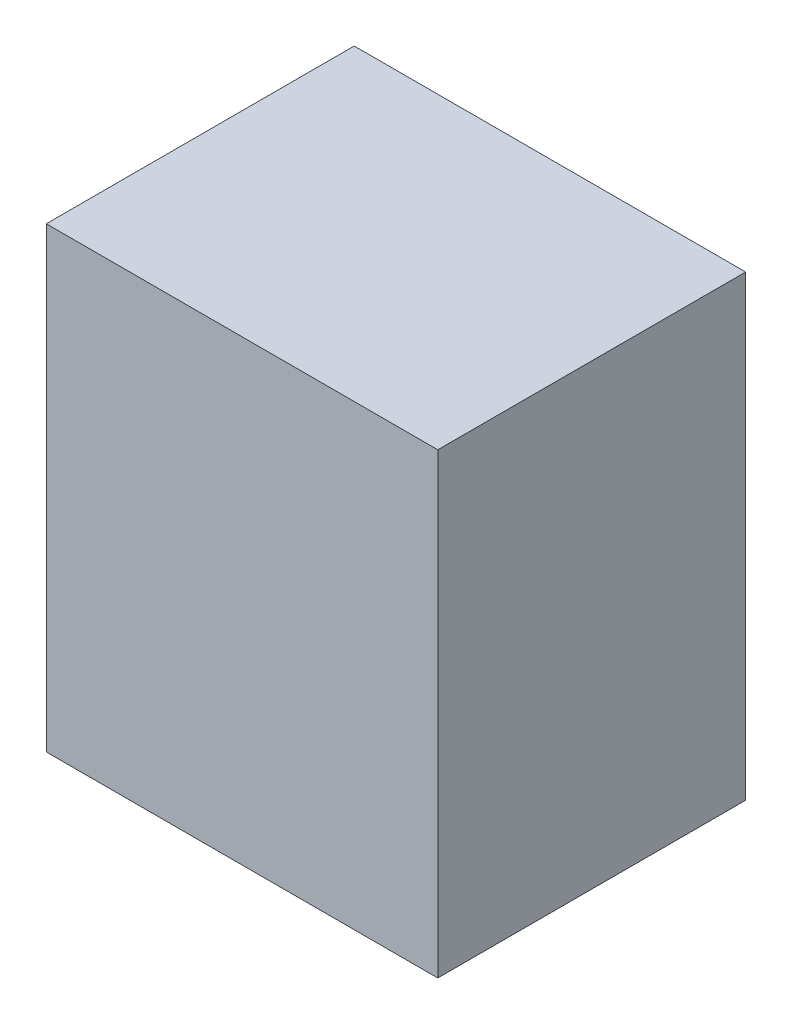
from build123d import *

# Parameters (mm, degrees)
SZKIC6_W                     = 170
SZKIC6_H                     = 200
DODANIE_WYCI_GNI_CIE3_DEPTH  = 4
SZKIC7_R                     = 5
SZKIC7_R_2                   = 1.5
SZKIC7_R_3                   = 3
SZKIC7_R_4                   = 0.8
SZKIC7_R_5                   = 1
SZKIC7_R_6                   = 1.6
DODANIE_WYCI_GNI_CIE4_DEPTH  = 10
SZKIC9_W                     = 178
SZKIC9_H                     = 208
SZKIC9_W_2                   = 170
SZKIC9_H_2                   = 200
DODANIE_WYCI_GNI_CIE5_DEPTH  = 140
DODANIE_WYCI_GNI_CIE7_DEPTH  = 20
DODANIE_WYCI_GNI_CIE8_DEPTH  = 20
SZKIC12_R                    = 5
SZKIC12_R_2                  = 1.5
DODANIE_WYCI_GNI_CIE9_DEPTH  = 70
SZKIC14_W                    = 8
SZKIC14_H                    = 2
DODANIE_WYCI_GNI_CIE10_DEPTH = 70


with BuildPart() as part:
    # Szkic6 → Dodanie-wyciągnięcie3 (new body)
    with BuildSketch(Plane(origin=(0, 0, 0), x_dir=(-1, 0, 0), z_dir=(0, 0, 1))):
        with Locations((-230.021965136, 874.532919951)):
            Rectangle(SZKIC6_W, SZKIC6_H)
    extrude(amount=DODANIE_WYCI_GNI_CIE3_DEPTH)

    # Szkic7 → Dodanie-wyciągnięcie4 (add)
    # profile 1 of 26: a face of its own
    with BuildSketch(Plane(origin=(0, 0, 0), x_dir=(-1, 0, 0), z_dir=(0, 0, 1))):
        with Locations(Location((-162.430886785, 962.073296905, 0), (0, 0, 180))):
            Circle(SZKIC7_R)
        with Locations(Location((-162.430886785, 962.073296905, 0), (0, 0, 180))):
            Circle(SZKIC7_R_2, mode=Mode.SUBTRACT)
    # profile 2 of 26: a face of its own
    with BuildSketch(Plane(origin=(0, 0, 0), x_dir=(-1, 0, 0), z_dir=(0, 0, 1))):
        with Locations(Location((-297.430886785, 962.073296905, 0), (0, 0, 180))):
            Circle(SZKIC7_R)
        with Locations(Location((-297.430886785, 962.073296905, 0), (0, 0, 180))):
            Circle(SZKIC7_R_2, mode=Mode.SUBTRACT)
    # profile 3 of 26: a face of its own
    with BuildSketch(Plane(origin=(0, 0, 0), x_dir=(-1, 0, 0), z_dir=(0, 0, 1))):
        with Locations(Location((-297.430886785, 915.073296905, 0), (0, 0, 180))):
            Circle(SZKIC7_R)
        with Locations(Location((-297.430886785, 915.073296905, 0), (0, 0, 180))):
            Circle(SZKIC7_R_2, mode=Mode.SUBTRACT)
    # profile 4 of 26: a face of its own
    with BuildSketch(Plane(origin=(0, 0, 0), x_dir=(-1, 0, 0), z_dir=(0, 0, 1))):
        with Locations(Location((-248.506775451, 886.753589049, 0), (0, 0, 180))):
            Circle(SZKIC7_R_3)
        with Locations(Location((-248.506775451, 886.753589049, 0), (0, 0, 180))):
            Circle(SZKIC7_R_2, mode=Mode.SUBTRACT)
    # profile 5 of 26: a face of its own
    with BuildSketch(Plane(origin=(0, 0, 0), x_dir=(-1, 0, 0), z_dir=(0, 0, 1))):
        with Locations(Location((-221.506775451, 886.753589049, 0), (0, 0, 180))):
            Circle(SZKIC7_R_3)
        with Locations(Location((-221.506775451, 886.753589049, 0), (0, 0, 180))):
            Circle(SZKIC7_R_2, mode=Mode.SUBTRACT)
    # profile 6 of 26: a face of its own
    with BuildSketch(Plane(origin=(0, 0, 0), x_dir=(-1, 0, 0), z_dir=(0, 0, 1))):
        with Locations(Location((-199.021965136, 896.532919951, 0), (0, 0, 180))):
            Circle(SZKIC7_R_3)
        with Locations(Location((-199.021965136, 896.532919951, 0), (0, 0, 180))):
            Circle(SZKIC7_R_4, mode=Mode.SUBTRACT)
    # profile 7 of 26: a face of its own
    with BuildSketch(Plane(origin=(0, 0, 0), x_dir=(-1, 0, 0), z_dir=(0, 0, 1))):
        with Locations(Location((-181.021965136, 896.532919951, 0), (0, 0, 180))):
            Circle(SZKIC7_R_3)
        with Locations(Location((-181.021965136, 896.532919951, 0), (0, 0, 180))):
            Circle(SZKIC7_R_4, mode=Mode.SUBTRACT)
    # profile 8 of 26: a face of its own
    with BuildSketch(Plane(origin=(0, 0, 0), x_dir=(-1, 0, 0), z_dir=(0, 0, 1))):
        with Locations(Location((-174.021965136, 896.532919951, 0), (0, 0, 180))):
            Circle(SZKIC7_R_3)
        with Locations(Location((-174.021965136, 896.532919951, 0), (0, 0, 180))):
            Circle(SZKIC7_R_4, mode=Mode.SUBTRACT)
    # profile 9 of 26: a face of its own
    with BuildSketch(Plane(origin=(0, 0, 0), x_dir=(-1, 0, 0), z_dir=(0, 0, 1))):
        with Locations(Location((-156.021965136, 896.532919951, 0), (0, 0, 180))):
            Circle(SZKIC7_R_3)
        with Locations(Location((-156.021965136, 896.532919951, 0), (0, 0, 180))):
            Circle(SZKIC7_R_4, mode=Mode.SUBTRACT)
    # profile 10 of 26: a face of its own
    with BuildSketch(Plane(origin=(0, 0, 0), x_dir=(-1, 0, 0), z_dir=(0, 0, 1))):
        with Locations(Location((-162.430886785, 915.073296905, 0), (0, 0, 180))):
            Circle(SZKIC7_R)
        with Locations(Location((-162.430886785, 915.073296905, 0), (0, 0, 180))):
            Circle(SZKIC7_R_2, mode=Mode.SUBTRACT)
    # profile 11 of 26: a face of its own
    with BuildSketch(Plane(origin=(0, 0, 0), x_dir=(-1, 0, 0), z_dir=(0, 0, 1))):
        with Locations(Location((-284.021965136, 855.572919951, 0), (0, 0, 180))):
            Circle(SZKIC7_R_3)
        with Locations(Location((-284.021965136, 855.572919951, 0), (0, 0, 180))):
            Circle(SZKIC7_R_5, mode=Mode.SUBTRACT)
    # profile 12 of 26: a face of its own
    with BuildSketch(Plane(origin=(0, 0, 0), x_dir=(-1, 0, 0), z_dir=(0, 0, 1))):
        with Locations(Location((-277.461965136, 840.572919951, 0), (0, 0, 180))):
            Circle(SZKIC7_R_3)
        with Locations(Location((-277.461965136, 840.572919951, 0), (0, 0, 180))):
            Circle(SZKIC7_R_6, mode=Mode.SUBTRACT)
    # profile 13 of 26: a face of its own
    with BuildSketch(Plane(origin=(0, 0, 0), x_dir=(-1, 0, 0), z_dir=(0, 0, 1))):
        with Locations(Location((-303.021965136, 855.572919951, 0), (0, 0, 180))):
            Circle(SZKIC7_R_3)
        with Locations(Location((-303.021965136, 855.572919951, 0), (0, 0, 180))):
            Circle(SZKIC7_R_5, mode=Mode.SUBTRACT)
    # profile 14 of 26: a face of its own
    with BuildSketch(Plane(origin=(0, 0, 0), x_dir=(-1, 0, 0), z_dir=(0, 0, 1))):
        with Locations(Location((-305.401965136, 840.572919951, 0), (0, 0, 180))):
            Circle(SZKIC7_R_3)
        with Locations(Location((-305.401965136, 840.572919951, 0), (0, 0, 180))):
            Circle(SZKIC7_R_6, mode=Mode.SUBTRACT)
    # profile 15 of 26: a face of its own
    with BuildSketch(Plane(origin=(0, 0, 0), x_dir=(-1, 0, 0), z_dir=(0, 0, 1))):
        with Locations(Location((-310.481965136, 789.772919951, 0), (0, 0, 180))):
            Circle(SZKIC7_R_3)
        with Locations(Location((-310.481965136, 789.772919951, 0), (0, 0, 180))):
            Circle(SZKIC7_R_6, mode=Mode.SUBTRACT)
    # profile 16 of 26: a face of its own
    with BuildSketch(Plane(origin=(0, 0, 0), x_dir=(-1, 0, 0), z_dir=(0, 0, 1))):
        with Locations(Location((-262.221965136, 789.772919951, 0), (0, 0, 180))):
            Circle(SZKIC7_R_3)
        with Locations(Location((-262.221965136, 789.772919951, 0), (0, 0, 180))):
            Circle(SZKIC7_R_6, mode=Mode.SUBTRACT)
    # profile 17 of 26: a face of its own
    with BuildSketch(Plane(origin=(0, 0, 0), x_dir=(-1, 0, 0), z_dir=(0, 0, 1))):
        with Locations(Location((-237.181965136, 786.032919951, 0), (0, 0, 180))):
            Circle(SZKIC7_R_3)
        with Locations(Location((-237.181965136, 786.032919951, 0), (0, 0, 180))):
            Circle(SZKIC7_R_2, mode=Mode.SUBTRACT)
    # profile 18 of 26: a face of its own
    with BuildSketch(Plane(origin=(0, 0, 0), x_dir=(-1, 0, 0), z_dir=(0, 0, 1))):
        with Locations(Location((-216.181965136, 786.032919951, 0), (0, 0, 180))):
            Circle(SZKIC7_R_3)
        with Locations(Location((-216.181965136, 786.032919951, 0), (0, 0, 180))):
            Circle(SZKIC7_R_2, mode=Mode.SUBTRACT)
    # profile 19 of 26: a face of its own
    with BuildSketch(Plane(origin=(0, 0, 0), x_dir=(-1, 0, 0), z_dir=(0, 0, 1))):
        with Locations(Location((-199.021965136, 818.532919951, 0), (0, 0, 180))):
            Circle(SZKIC7_R_3)
        with Locations(Location((-199.021965136, 818.532919951, 0), (0, 0, 180))):
            Circle(SZKIC7_R_4, mode=Mode.SUBTRACT)
    # profile 20 of 26: a face of its own
    with BuildSketch(Plane(origin=(0, 0, 0), x_dir=(-1, 0, 0), z_dir=(0, 0, 1))):
        with Locations(Location((-181.021965136, 818.532919951, 0), (0, 0, 180))):
            Circle(SZKIC7_R_3)
        with Locations(Location((-181.021965136, 818.532919951, 0), (0, 0, 180))):
            Circle(SZKIC7_R_4, mode=Mode.SUBTRACT)
    # profile 21 of 26: a face of its own
    with BuildSketch(Plane(origin=(0, 0, 0), x_dir=(-1, 0, 0), z_dir=(0, 0, 1))):
        with Locations(Location((-174.021965136, 818.532919951, 0), (0, 0, 180))):
            Circle(SZKIC7_R_3)
        with Locations(Location((-174.021965136, 818.532919951, 0), (0, 0, 180))):
            Circle(SZKIC7_R_4, mode=Mode.SUBTRACT)
    # profile 22 of 26: a face of its own
    with BuildSketch(Plane(origin=(0, 0, 0), x_dir=(-1, 0, 0), z_dir=(0, 0, 1))):
        with Locations(Location((-156.021965136, 818.532919951, 0), (0, 0, 180))):
            Circle(SZKIC7_R_3)
        with Locations(Location((-156.021965136, 818.532919951, 0), (0, 0, 180))):
            Circle(SZKIC7_R_4, mode=Mode.SUBTRACT)
    # profile 23 of 26: a face of its own
    with BuildSketch(Plane(origin=(0, 0, 0), x_dir=(-1, 0, 0), z_dir=(0, 0, 1))):
        with Locations(Location((-155.521262892, 805.032919951, 0), (0, 0, 180))):
            Circle(SZKIC7_R_3)
        with Locations(Location((-155.521262892, 805.032919951, 0), (0, 0, 180))):
            Circle(SZKIC7_R_2, mode=Mode.SUBTRACT)
    # profile 24 of 26: a face of its own
    with BuildSketch(Plane(origin=(0, 0, 0), x_dir=(-1, 0, 0), z_dir=(0, 0, 1))):
        with Locations(Location((-193.821262892, 805.032919951, 0), (0, 0, 180))):
            Circle(SZKIC7_R_3)
        with Locations(Location((-193.821262892, 805.032919951, 0), (0, 0, 180))):
            Circle(SZKIC7_R_2, mode=Mode.SUBTRACT)
    # profile 25 of 26: a face of its own
    with BuildSketch(Plane(origin=(0, 0, 0), x_dir=(-1, 0, 0), z_dir=(0, 0, 1))):
        with Locations(Location((-193.821262892, 787.032919951, 0), (0, 0, 180))):
            Circle(SZKIC7_R_3)
        with Locations(Location((-193.821262892, 787.032919951, 0), (0, 0, 180))):
            Circle(SZKIC7_R_2, mode=Mode.SUBTRACT)
    # profile 26 of 26: a face of its own
    with BuildSketch(Plane(origin=(0, 0, 0), x_dir=(-1, 0, 0), z_dir=(0, 0, 1))):
        with Locations(Location((-155.521262892, 787.032919951, 0), (0, 0, 180))):
            Circle(SZKIC7_R_3)
        with Locations(Location((-155.521262892, 787.032919951, 0), (0, 0, 180))):
            Circle(SZKIC7_R_2, mode=Mode.SUBTRACT)
    extrude(amount=-DODANIE_WYCI_GNI_CIE4_DEPTH)

    # Szkic9 → Dodanie-wyciągnięcie5 (add)
    with BuildSketch(Plane.XY.offset(4)):
        with Locations((230.021965136, -874.532919951)):
            Rectangle(SZKIC9_W, SZKIC9_H)
        with Locations((230.021965136, -874.532919951)):
            Rectangle(SZKIC9_W_2, SZKIC9_H_2, mode=Mode.SUBTRACT)
    extrude(amount=-DODANIE_WYCI_GNI_CIE5_DEPTH)

    # Szkic8 → Dodanie-wyciągnięcie7 (add)
    with BuildSketch(Plane(origin=(0, 0, 0), x_dir=(-1, 0, 0), z_dir=(0, 0, 1))):
        Polygon((-291.415951674, 944.785015546), (-289.915951674, 944.785015546), (-289.915951674, 967.785015546), (-172.915951674, 967.785015546), (-172.915951674, 944.285015546), (-171.415951674, 944.285015546), (-171.415951674, 969.285015546), (-291.415951674, 969.285015546), align=None)
        Polygon((-172.915951674, 909.817403318), (-289.915951674, 909.817403318), (-289.915951674, 932.785015546), (-291.415951674, 932.785015546), (-291.415951674, 908.317403318), (-171.415951674, 908.317403318), (-171.415951674, 909.817403318), (-171.415951674, 933.285015546), (-172.915951674, 933.285015546), align=None)
    extrude(amount=-DODANIE_WYCI_GNI_CIE7_DEPTH)

    # Szkic11 → Dodanie-wyciągnięcie8 (add)
    with BuildSketch(Plane(origin=(0, 0, 0), x_dir=(-1, 0, 0), z_dir=(0, 0, -1))):
        with BuildLine():
            ThreePointArc((-292.430886785, -915.073296905), (-293.895352879, -918.608830811), (-297.430886785, -920.073296905))
            Line((-297.430886785, -920.073296905), (-291.415951674, -920.073296905))
            Line((-291.415951674, -920.073296905), (-291.415951674, -910.073296905))
            Line((-291.415951674, -910.073296905), (-297.430886785, -910.073296905))
            ThreePointArc((-297.430886785, -910.073296905), (-293.895352879, -911.537762999), (-292.430886785, -915.073296905))
        make_face()
        with BuildLine():
            ThreePointArc((-292.430886785, -962.073296905), (-293.895352879, -965.608830811), (-297.430886785, -967.073296905))
            Line((-297.430886785, -967.073296905), (-291.415951674, -967.073296905))
            Line((-291.415951674, -967.073296905), (-291.415951674, -957.073296905))
            Line((-291.415951674, -957.073296905), (-297.430886785, -957.073296905))
            ThreePointArc((-297.430886785, -957.073296905), (-293.895352879, -958.537762999), (-292.430886785, -962.073296905))
        make_face()
        with BuildLine():
            Line((-171.415951674, -920.073296905), (-162.430886785, -920.073296905))
            ThreePointArc((-162.430886785, -920.073296905), (-167.430886785, -915.073296905), (-162.430886785, -910.073296905))
            Line((-162.430886785, -910.073296905), (-171.415951674, -910.073296905))
            Line((-171.415951674, -910.073296905), (-171.415951674, -920.073296905))
        make_face()
        with BuildLine():
            Line((-171.415951674, -967.073296905), (-162.430886785, -967.073296905))
            ThreePointArc((-162.430886785, -967.073296905), (-167.430886785, -962.073296905), (-162.430886785, -957.073296905))
            Line((-162.430886785, -957.073296905), (-171.415951674, -957.073296905))
            Line((-171.415951674, -957.073296905), (-171.415951674, -967.073296905))
        make_face()
    extrude(amount=DODANIE_WYCI_GNI_CIE8_DEPTH)

    # Szkic12 → Dodanie-wyciągnięcie9 (add)
    # profile 1 of 4: a face of its own
    with BuildSketch(Plane(origin=(0, 0, -10), x_dir=(-1, 0, 0), z_dir=(0, 0, -1))):
        with Locations(Location((-297.430886785, -915.073296905, 0), (0, 0, 90))):
            Circle(SZKIC12_R)
        with Locations(Location((-297.430886785, -915.073296905, 0), (0, 0, 180))):
            Circle(SZKIC12_R_2, mode=Mode.SUBTRACT)
    # profile 2 of 4: a face of its own
    with BuildSketch(Plane(origin=(0, 0, -10), x_dir=(-1, 0, 0), z_dir=(0, 0, -1))):
        with Locations(Location((-297.430886785, -962.073296905, 0), (0, 0, 90))):
            Circle(SZKIC12_R)
        with Locations(Location((-297.430886785, -962.073296905, 0), (0, 0, 180))):
            Circle(SZKIC12_R_2, mode=Mode.SUBTRACT)
    # profile 3 of 4: a face of its own
    with BuildSketch(Plane(origin=(0, 0, -10), x_dir=(-1, 0, 0), z_dir=(0, 0, -1))):
        with Locations(Location((-162.430886785, -915.073296905, 0), (0, 0, 90))):
            Circle(SZKIC12_R)
        with Locations(Location((-162.430886785, -915.073296905, 0), (0, 0, 180))):
            Circle(SZKIC12_R_2, mode=Mode.SUBTRACT)
    # profile 4 of 4: a face of its own
    with BuildSketch(Plane(origin=(0, 0, -10), x_dir=(-1, 0, 0), z_dir=(0, 0, -1))):
        with Locations(Location((-162.430886785, -962.073296905, 0), (0, 0, 90))):
            Circle(SZKIC12_R)
        with Locations(Location((-162.430886785, -962.073296905, 0), (0, 0, 180))):
            Circle(SZKIC12_R_2, mode=Mode.SUBTRACT)
    extrude(amount=DODANIE_WYCI_GNI_CIE9_DEPTH)

    # Szkic14 → Dodanie-wyciągnięcie10 (add)
    with BuildSketch(Plane(origin=(0, 0, 0), x_dir=(-1, 0, 0), z_dir=(0, 0, -1))):
        with Locations((-275.681965136, -775.532919951)):
            Rectangle(SZKIC14_W, SZKIC14_H)
    extrude(amount=DODANIE_WYCI_GNI_CIE10_DEPTH)


solid = part.part
